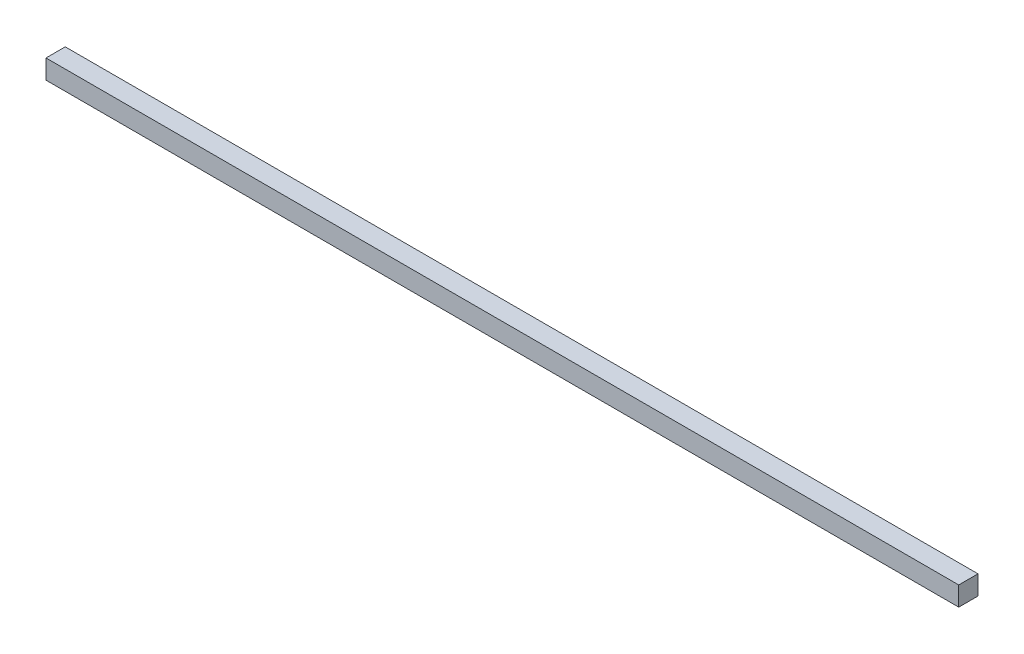
from build123d import *

# Parameters (mm, degrees)
SKETCH1_W           = 6.35
SKETCH1_H           = 6.35
BOSS_EXTRUDE1_DEPTH = 150.495


with BuildPart() as part:
    # Sketch1 → Boss-Extrude1 (new, symmetric)
    with BuildSketch(Plane(origin=(0, 0, 0), x_dir=(0, 0, -1), z_dir=(1, 0, 0))):
        Rectangle(SKETCH1_W, SKETCH1_H)
    extrude(amount=BOSS_EXTRUDE1_DEPTH, both=True)


solid = part.part
